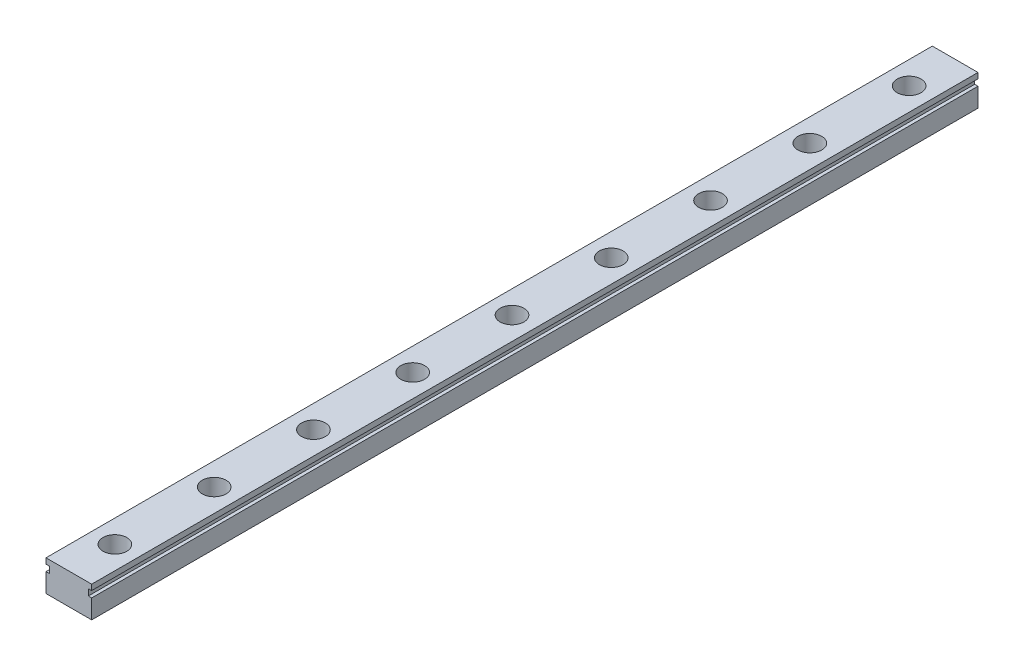
from build123d import *

# Parameters (mm, degrees)
SKETCH1_W           = 11.5
SKETCH1_H           = 7.8
BOSS_EXTRUDE1_DEPTH = 223.2
SKETCH2_W           = 0.835250229
SKETCH2_H           = 1.6
CUT_EXTRUDE1_DEPTH  = 224.308111138
SKETCH3_R           = 3
CUT_EXTRUDE2_DEPTH  = 4.7
SKETCH4_R           = 1.7
CUT_EXTRUDE3_DEPTH  = 224.323515331


with BuildPart() as part:
    # Sketch1 → Boss-Extrude1 (new body)
    with BuildSketch(Plane.XY):
        Rectangle(SKETCH1_W, SKETCH1_H)
    extrude(amount=BOSS_EXTRUDE1_DEPTH)

    # Sketch2 → Cut-Extrude1 (cut, through all)
    with BuildSketch(Plane.XY.offset(223.2)):
        with Locations((5.332374886, 1.7)):
            Rectangle(SKETCH2_W, SKETCH2_H)
        with Locations((-5.332374886, 1.7)):
            Rectangle(SKETCH2_W, SKETCH2_H)
    extrude(amount=-CUT_EXTRUDE1_DEPTH, mode=Mode.SUBTRACT)

    # Sketch3 → Cut-Extrude2 (cut)
    with BuildSketch(Plane(origin=(0, 3.9, 0), x_dir=(1, 0, 0), z_dir=(0, 1, 0))):
        with Locations(Location((0, -211.6, 0), (0, 0, 270))):
            Circle(SKETCH3_R)
        with Locations(Location((0, -186.6, 0), (0, 0, 270))):
            Circle(SKETCH3_R)
        with Locations(Location((0, -161.6, 0), (0, 0, 270))):
            Circle(SKETCH3_R)
        with Locations(Location((0, -136.6, 0), (0, 0, 270))):
            Circle(SKETCH3_R)
        with Locations(Location((0, -111.6, 0), (0, 0, 270))):
            Circle(SKETCH3_R)
        with Locations(Location((0, -86.6, 0), (0, 0, 270))):
            Circle(SKETCH3_R)
        with Locations(Location((0, -61.6, 0), (0, 0, 270))):
            Circle(SKETCH3_R)
        with Locations(Location((0, -36.6, 0), (0, 0, 270))):
            Circle(SKETCH3_R)
        with Locations(Location((0, -11.6, 0), (0, 0, 270))):
            Circle(SKETCH3_R)
    extrude(amount=-CUT_EXTRUDE2_DEPTH, mode=Mode.SUBTRACT)

    # Sketch4 → Cut-Extrude3 (cut, through all)
    with BuildSketch(Plane(origin=(0, -0.8, 0), x_dir=(1, 0, 0), z_dir=(0, 1, 0))):
        with Locations(Location((0, -211.6, 0), (0, 0, 270))):
            Circle(SKETCH4_R)
        with Locations(Location((0, -186.6, 0), (0, 0, 270))):
            Circle(SKETCH4_R)
        with Locations(Location((0, -161.6, 0), (0, 0, 270))):
            Circle(SKETCH4_R)
        with Locations(Location((0, -136.6, 0), (0, 0, 270))):
            Circle(SKETCH4_R)
        with Locations(Location((0, -111.6, 0), (0, 0, 270))):
            Circle(SKETCH4_R)
        with Locations(Location((0, -86.6, 0), (0, 0, 270))):
            Circle(SKETCH4_R)
        with Locations(Location((0, -61.6, 0), (0, 0, 270))):
            Circle(SKETCH4_R)
        with Locations(Location((0, -36.6, 0), (0, 0, 270))):
            Circle(SKETCH4_R)
        with Locations(Location((0, -11.6, 0), (0, 0, 270))):
            Circle(SKETCH4_R)
    extrude(amount=-CUT_EXTRUDE3_DEPTH, mode=Mode.SUBTRACT)


solid = part.part
